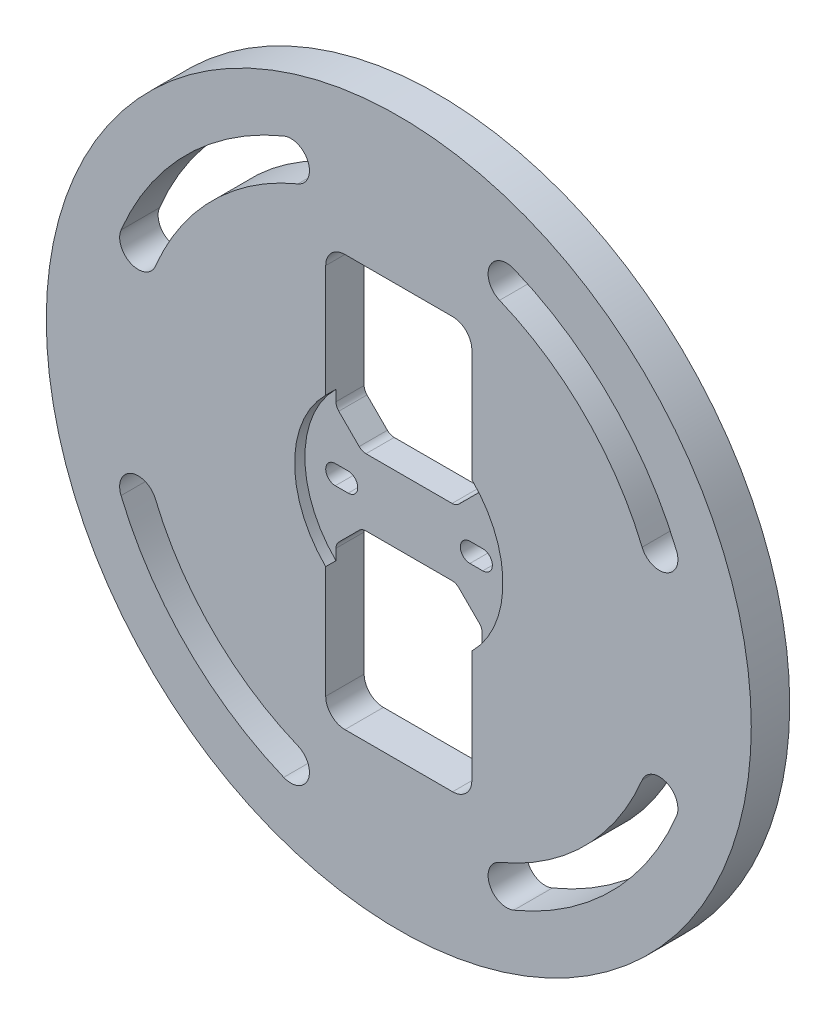
from build123d import *

# Parameters (mm, degrees)
SKETCH1_R               = 55
BOSS_EXTRUDE1_DEPTH     = 6
CUT_EXTRUDE1_DEPTH      = 79.012819459
SKETCH4_R               = 16.25
CUT_EXTRUDE2_DEPTH      = 1.6
CUT_EXTRUDE3_DEPTH      = 78.906097322
CUT_EXTRUDE4_DEPTH      = 78.906097322
CUT_EXTRUDE4_DEPTH_BACK = 78.906097322


with BuildPart() as part:
    # Sketch1 → Boss-Extrude1 (new body)
    with BuildSketch(Plane.XY):
        Circle(SKETCH1_R)
    extrude(amount=BOSS_EXTRUDE1_DEPTH)

    # Sketch3 → Cut-Extrude1 (cut, through all)
    with BuildSketch(Plane.XY.offset(6)):
        with BuildLine():
            ThreePointArc((-15.72828907, 37.971448786), (-14.15882038, 41.760481384), (-17.947852978, 43.329950075))
            ThreePointArc((-17.947852978, 43.329950075), (-33.163308038, 33.163308038), (-43.329950075, 17.947852978))
            ThreePointArc((-43.329950075, 17.947852978), (-41.760481384, 14.15882038), (-37.971448786, 15.72828907))
            ThreePointArc((-37.971448786, 15.72828907), (-29.062088707, 29.062088707), (-15.72828907, 37.971448786))
        make_face()
        with BuildLine():
            ThreePointArc((17.947852978, 43.329950075), (14.15882038, 41.760481384), (15.72828907, 37.971448786))
            ThreePointArc((15.72828907, 37.971448786), (29.062088707, 29.062088707), (37.971448786, 15.72828907))
            ThreePointArc((37.971448786, 15.72828907), (41.760481384, 14.15882038), (43.329950075, 17.947852978))
            ThreePointArc((43.329950075, 17.947852978), (33.163308038, 33.163308038), (17.947852978, 43.329950075))
        make_face()
        with BuildLine():
            ThreePointArc((43.329950075, -17.947852978), (41.760481384, -14.15882038), (37.971448786, -15.72828907))
            ThreePointArc((37.971448786, -15.72828907), (29.062088707, -29.062088707), (15.72828907, -37.971448786))
            ThreePointArc((15.72828907, -37.971448786), (14.15882038, -41.760481384), (17.947852978, -43.329950075))
            ThreePointArc((17.947852978, -43.329950075), (33.163308038, -33.163308038), (43.329950075, -17.947852978))
        make_face()
        with BuildLine():
            ThreePointArc((-17.947852978, -43.329950075), (-14.15882038, -41.760481384), (-15.72828907, -37.971448786))
            ThreePointArc((-15.72828907, -37.971448786), (-29.062088707, -29.062088707), (-37.971448786, -15.72828907))
            ThreePointArc((-37.971448786, -15.72828907), (-41.760481384, -14.15882038), (-43.329950075, -17.947852978))
            ThreePointArc((-43.329950075, -17.947852978), (-33.163308038, -33.163308038), (-17.947852978, -43.329950075))
        make_face()
    extrude(amount=-CUT_EXTRUDE1_DEPTH, mode=Mode.SUBTRACT)

    # Sketch4 → Cut-Extrude2 (cut)
    with BuildSketch(Plane.XY.offset(6)):
        Circle(SKETCH4_R)
    extrude(amount=-CUT_EXTRUDE2_DEPTH, mode=Mode.SUBTRACT)

    # Sketch5 → Cut-Extrude3 (cut, through all)
    with BuildSketch(Plane.XY.offset(4.4)):
        with BuildLine():
            Line((-5.656854249, -7.778174593), (-8.838834765, -10.960155108))
            ThreePointArc((-8.838834765, -10.960155108), (-10.960155108, -10.960155108), (-10.960155108, -8.838834765))
            Line((-10.960155108, -8.838834765), (-7.778174593, -5.656854249))
            ThreePointArc((-7.778174593, -5.656854249), (-5.656854249, -5.656854249), (-5.656854249, -7.778174593))
        make_face()
        with BuildLine():
            Line((-9.5, -1.5), (-11.5, -1.5))
            ThreePointArc((-11.5, -1.5), (-13, 0), (-11.5, 1.5))
            Line((-11.5, 1.5), (-9.5, 1.5))
            ThreePointArc((-9.5, 1.5), (-8, 0), (-9.5, -1.5))
        make_face()
        with BuildLine():
            Line((-7.778174593, 5.656854249), (-10.960155108, 8.838834765))
            ThreePointArc((-10.960155108, 8.838834765), (-10.960155108, 10.960155108), (-8.838834765, 10.960155108))
            Line((-8.838834765, 10.960155108), (-5.656854249, 7.778174593))
            ThreePointArc((-5.656854249, 7.778174593), (-5.656854249, 5.656854249), (-7.778174593, 5.656854249))
        make_face()
        with BuildLine():
            Line((5.656854249, 7.778174593), (8.838834765, 10.960155108))
            ThreePointArc((8.838834765, 10.960155108), (10.960155108, 10.960155108), (10.960155108, 8.838834765))
            Line((10.960155108, 8.838834765), (7.778174593, 5.656854249))
            ThreePointArc((7.778174593, 5.656854249), (5.656854249, 5.656854249), (5.656854249, 7.778174593))
        make_face()
        with BuildLine():
            Line((7.778174593, -5.656854249), (10.960155108, -8.838834765))
            ThreePointArc((10.960155108, -8.838834765), (10.960155108, -10.960155108), (8.838834765, -10.960155108))
            Line((8.838834765, -10.960155108), (5.656854249, -7.778174593))
            ThreePointArc((5.656854249, -7.778174593), (5.656854249, -5.656854249), (7.778174593, -5.656854249))
        make_face()
        with BuildLine():
            Line((9.5, 1.5), (11.5, 1.5))
            ThreePointArc((11.5, 1.5), (13, 0), (11.5, -1.5))
            Line((11.5, -1.5), (9.5, -1.5))
            ThreePointArc((9.5, -1.5), (8, 0), (9.5, 1.5))
        make_face()
    extrude(amount=-CUT_EXTRUDE3_DEPTH, mode=Mode.SUBTRACT)

    # Sketch6 → Cut-Extrude4 (cut, two sides: drawn at the far end of the back side and taken through both)
    with BuildSketch(Plane.XY.offset(4.4).offset(-CUT_EXTRUDE4_DEPTH_BACK)):
        with BuildLine():
            Line((-8.399494937, -32.100505062), (8.399494937, -32.100505062))
            ThreePointArc((8.399494937, -32.100505062), (10.52081528, -31.221825406), (11.399494937, -29.100505062))
            Line((11.399494937, -29.100505062), (11.399494937, -9.899494935))
            Line((11.399494937, -9.899494935), (6.717514421, -5.21751442))
            Line((6.717514421, -5.21751442), (-6.717514421, -5.21751442))
            Line((-6.717514421, -5.21751442), (-11.399494937, -9.899494935))
            Line((-11.399494937, -9.899494935), (-11.399494937, -29.100505062))
            ThreePointArc((-11.399494937, -29.100505062), (-10.52081528, -31.221825406), (-8.399494937, -32.100505062))
        make_face()
        with BuildLine():
            Line((8.399494937, 32.100505063), (-8.399494937, 32.100505063))
            ThreePointArc((-8.399494937, 32.100505063), (-10.52081528, 31.221825407), (-11.399494937, 29.100505063))
            Line((-11.399494937, 29.100505063), (-11.399494937, 9.899494937))
            Line((-11.399494937, 9.899494937), (-6.717514421, 5.217514421))
            Line((-6.717514421, 5.217514421), (6.717514421, 5.217514421))
            Line((6.717514421, 5.217514421), (11.399494937, 9.899494937))
            Line((11.399494937, 9.899494937), (11.399494937, 29.100505063))
            ThreePointArc((11.399494937, 29.100505063), (10.52081528, 31.221825407), (8.399494937, 32.100505063))
        make_face()
    extrude(amount=CUT_EXTRUDE4_DEPTH + CUT_EXTRUDE4_DEPTH_BACK, mode=Mode.SUBTRACT)


solid = part.part
